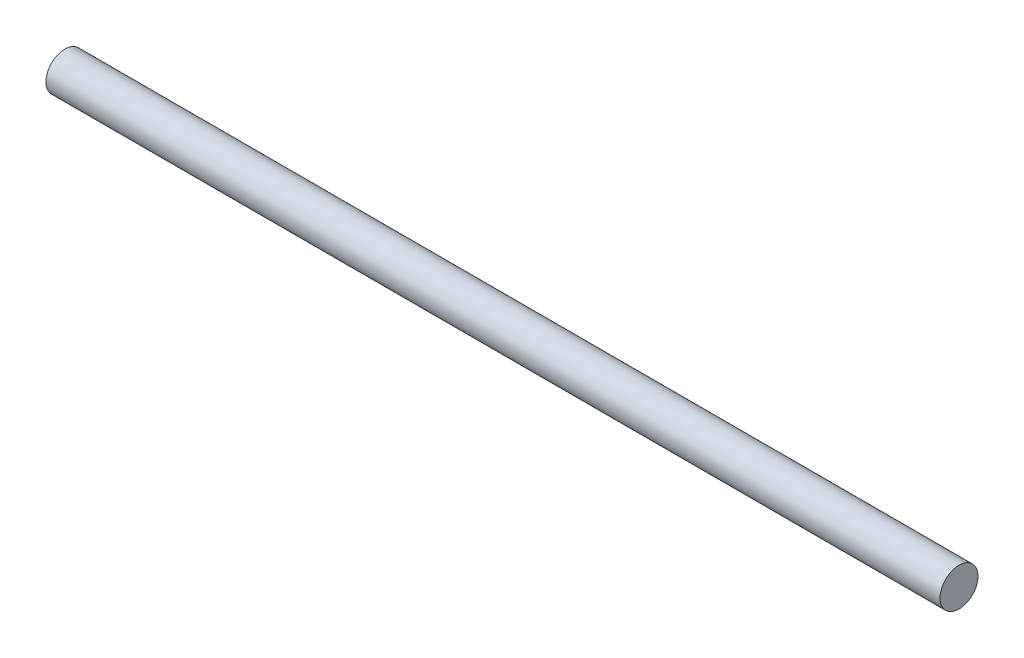
from build123d import *

# Parameters (mm, degrees)
SKETCH1_R           = 1.7526
BOSS_EXTRUDE1_DEPTH = 41.275


with BuildPart() as part:
    # Sketch1 → Boss-Extrude1 (new, symmetric)
    with BuildSketch(Plane(origin=(0, 0, 0), x_dir=(0, 0, -1), z_dir=(1, 0, 0))):
        Circle(SKETCH1_R)
    extrude(amount=BOSS_EXTRUDE1_DEPTH, both=True)


solid = part.part
